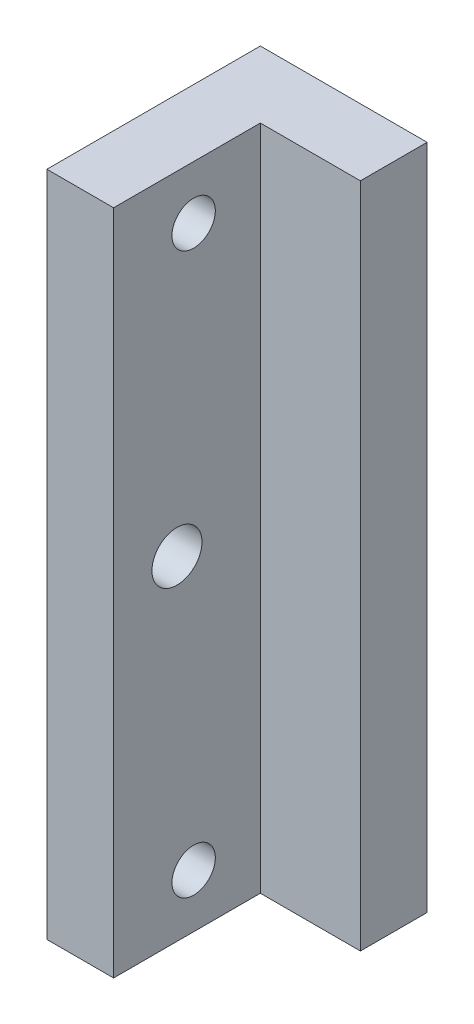
from build123d import *

# Parameters (mm, degrees)
BOSS_EXTRUDE1_DEPTH        = 50
F_6_5_6_5_DIAMETER_HOLE1_D = 6.5
SKETCH4_R                  = 3.75
CUT_EXTRUDE1_DEPTH         = 65.412731661


with BuildPart() as part:
    # Sketch1 → Boss-Extrude1 (new, symmetric)
    with BuildSketch(Plane(origin=(0, 0, 0), x_dir=(1, 0, 0), z_dir=(0, 1, 0))):
        Polygon((25, 0), (0, 0), (0, -32), (10, -32), (10, -10), (25, -10), align=None)
    extrude(amount=BOSS_EXTRUDE1_DEPTH, both=True)

    # Ø6.5 (6.5) Diameter Hole1 (through all)
    with Locations(Plane.ZY):
        with Locations((20, -42), (20, 42)):
            Hole(F_6_5_6_5_DIAMETER_HOLE1_D / 2)

    # Sketch4 → Cut-Extrude1 (cut, through all)
    with BuildSketch(Plane.ZY):
        with Locations((22.5, 0)):
            Circle(SKETCH4_R)
    extrude(amount=-CUT_EXTRUDE1_DEPTH, mode=Mode.SUBTRACT)


solid = part.part
